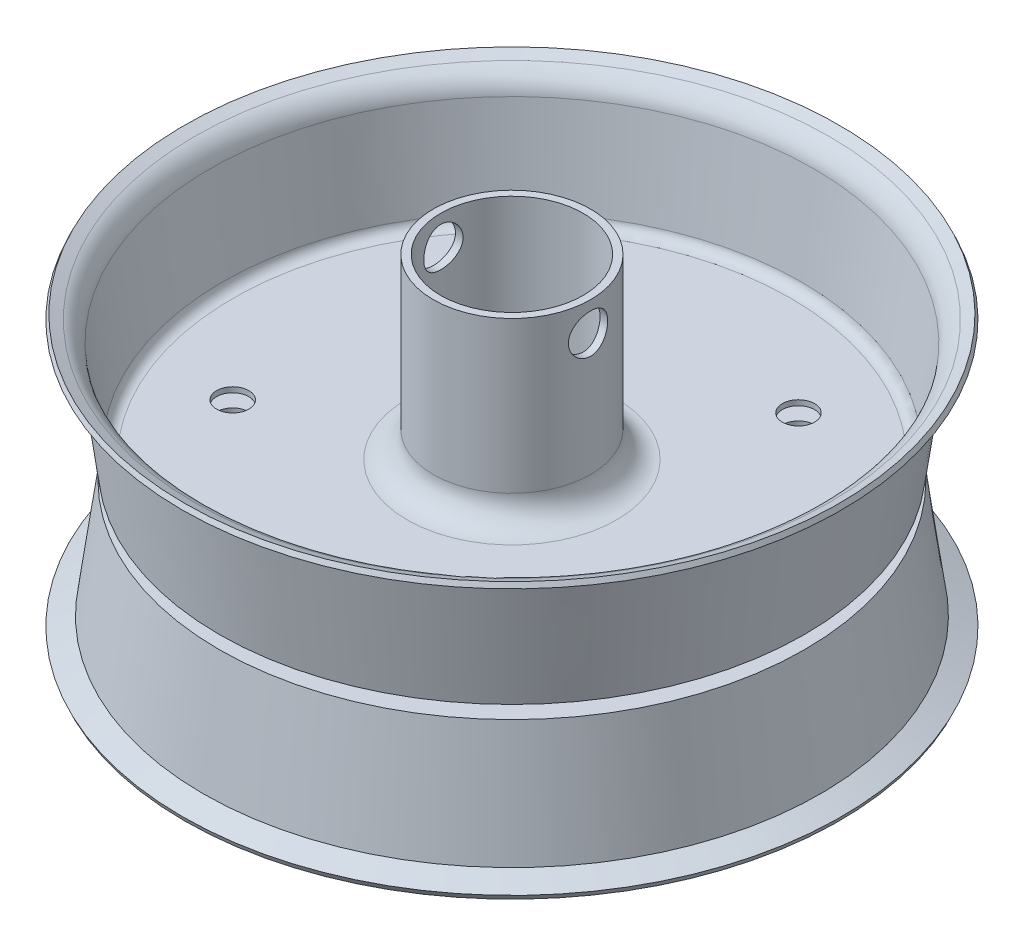
from build123d import *

# Parameters (mm, degrees)
SKETCH1_R                      = 19.05
SKETCH1_R_2                    = 17.272
BOSS_EXTRUDE1_DEPTH            = 73.152
FILLET1_R                      = 6.35
FILLET2_R                      = 2.54
FILLET3_R                      = 6.35
CUT_EXTRUDE1_REACH             = 122.908
SKETCH2_R                      = 3.9
FILLET1_OF_MIRROR1_R           = 6.35
FILLET2_OF_MIRROR1_R           = 2.54
FILLET3_OF_MIRROR1_R           = 6.35
CUT_EXTRUDE2_REACH             = 136.597
SKETCH4_R                      = 4.7625
CUT_EXTRUDE2_DIRECTION_2_REACH = 136.597


with BuildPart() as part:
    # Sketch1 → Boss-Extrude1 (new body)
    with BuildSketch(Plane(origin=(0, 0, 0), x_dir=(1, 0, 0), z_dir=(0, 1, 0))):
        with Locations(Location((0, 0, 0), (0, 0, 270))):
            Circle(SKETCH1_R)
        with Locations(Location((0, 0, 0), (0, 0, 270))):
            Circle(SKETCH1_R_2, mode=Mode.SUBTRACT)
    extrude(amount=BOSS_EXTRUDE1_DEPTH)

    # Sketch3 → Revolve1 (revolve)
    with BuildSketch(Plane(origin=(0, 0, 0), x_dir=(0, 0, -1), z_dir=(1, 0, 0))):
        Polygon((-19.05, 30.099), (-69.85, 30.099), (-73.66, 58.039), (-79.375, 60.579), (-79.890795852, 59.418459333), (-74.822704503, 57.165974289), (-70.958571646, 28.829), (-19.05, 28.829), align=None)
    revolve1 = revolve(axis=Axis((0, 73.152, 0), (0, -1, 0)))

    # Fillet1
    fillet1_edges = [part.edges().sort_by_distance(p)[0] for p in [
        (0, 30.099, -19.05),
    ]]
    fillet(fillet1_edges, radius=FILLET1_R)

    # Fillet2
    fillet2_edges = [part.edges().sort_by_distance(p)[0] for p in [
        (0, 30.099, -69.85),
    ]]
    fillet(fillet2_edges, radius=FILLET2_R)

    # Fillet3
    fillet3_edges = [part.edges().sort_by_distance(p)[0] for p in [
        (0, 58.039, -73.66),
    ]]
    fillet(fillet3_edges, radius=FILLET3_R)

    # Sketch2 → Cut-Extrude1 (cut, up to next)
    with BuildSketch(Plane(origin=(0, 30.099, 0), x_dir=(1, 0, 0), z_dir=(0, 1, 0)), mode=Mode.PRIVATE) as cut_extrude1_sk1:
        with Locations(Location((-34.614825389, 37.48444822, 0), (0, 0, 270))):
            Circle(SKETCH2_R)
    cut_extrude1_tool1 = extrude(cut_extrude1_sk1.sketch, amount=-CUT_EXTRUDE1_REACH, mode=Mode.PRIVATE) & part.part
    # Sketch2 → Cut-Extrude1 (cut, up to next)
    with BuildSketch(Plane(origin=(0, 30.099, 0), x_dir=(1, 0, 0), z_dir=(0, 1, 0)), mode=Mode.PRIVATE) as cut_extrude1_sk2:
        with Locations(Location((24.953259436, 44.503986772, 0), (0, 0, 270))):
            Circle(SKETCH2_R)
    cut_extrude1_tool2 = extrude(cut_extrude1_sk2.sketch, amount=-CUT_EXTRUDE1_REACH, mode=Mode.PRIVATE) & part.part
    # Sketch2 → Cut-Extrude1 (cut, up to next)
    with BuildSketch(Plane(origin=(0, 30.099, 0), x_dir=(1, 0, 0), z_dir=(0, 1, 0)), mode=Mode.PRIVATE) as cut_extrude1_sk3:
        with Locations(Location((50.036787851, -9.97947176, 0), (0, 0, 270))):
            Circle(SKETCH2_R)
    cut_extrude1_tool3 = extrude(cut_extrude1_sk3.sketch, amount=-CUT_EXTRUDE1_REACH, mode=Mode.PRIVATE) & part.part
    # Sketch2 → Cut-Extrude1 (cut, up to next)
    with BuildSketch(Plane(origin=(0, 30.099, 0), x_dir=(1, 0, 0), z_dir=(0, 1, 0)), mode=Mode.PRIVATE) as cut_extrude1_sk4:
        with Locations(Location((5.971176144, -50.671639509, 0), (0, 0, 270))):
            Circle(SKETCH2_R)
    cut_extrude1_tool4 = extrude(cut_extrude1_sk4.sketch, amount=-CUT_EXTRUDE1_REACH, mode=Mode.PRIVATE) & part.part
    # Sketch2 → Cut-Extrude1 (cut, up to next)
    with BuildSketch(Plane(origin=(0, 30.099, 0), x_dir=(1, 0, 0), z_dir=(0, 1, 0)), mode=Mode.PRIVATE) as cut_extrude1_sk5:
        with Locations(Location((-46.346398042, -21.337323722, 0), (0, 0, 270))):
            Circle(SKETCH2_R)
    cut_extrude1_tool5 = extrude(cut_extrude1_sk5.sketch, amount=-CUT_EXTRUDE1_REACH, mode=Mode.PRIVATE) & part.part
    cut_extrude1_1 = cut_extrude1_tool1.solids().sort_by_distance((-34.614825, 30.099, -37.484448))[0]
    add(cut_extrude1_1, mode=Mode.SUBTRACT)
    cut_extrude1_2 = cut_extrude1_tool2.solids().sort_by_distance((24.953259, 30.099, -44.503987))[0]
    add(cut_extrude1_2, mode=Mode.SUBTRACT)
    cut_extrude1_3 = cut_extrude1_tool3.solids().sort_by_distance((50.036788, 30.099, 9.979472))[0]
    add(cut_extrude1_3, mode=Mode.SUBTRACT)
    cut_extrude1_4 = cut_extrude1_tool4.solids().sort_by_distance((5.971176, 30.099, 50.67164))[0]
    add(cut_extrude1_4, mode=Mode.SUBTRACT)
    cut_extrude1_5 = cut_extrude1_tool5.solids().sort_by_distance((-46.346398, 30.099, 21.337324))[0]
    add(cut_extrude1_5, mode=Mode.SUBTRACT)
    cut_extrude1 = cut_extrude1_1 + cut_extrude1_2 + cut_extrude1_3 + cut_extrude1_4 + cut_extrude1_5  # Cut-Extrude1 as one shape, for the pattern or mirror that repeats it

    # Mirror1: Revolve1, Cut-Extrude1 across plane
    add(revolve1.mirror(Plane(origin=(0, 27.2415, 0), x_dir=(0, 0, 1), z_dir=(0, -1, 0))))
    add(cut_extrude1.mirror(Plane(origin=(0, 27.2415, 0), x_dir=(0, 0, 1), z_dir=(0, -1, 0))), mode=Mode.SUBTRACT)

    # Fillet1 of Mirror1
    fillet1_of_mirror1_edges = [part.edges().sort_by_distance(p)[0] for p in [
        (0, 24.384, -19.05),
    ]]
    fillet(fillet1_of_mirror1_edges, radius=FILLET1_OF_MIRROR1_R)

    # Fillet2 of Mirror1
    fillet2_of_mirror1_edges = [part.edges().sort_by_distance(p)[0] for p in [
        (0, 24.384, -69.85),
    ]]
    fillet(fillet2_of_mirror1_edges, radius=FILLET2_OF_MIRROR1_R)

    # Fillet3 of Mirror1
    fillet3_of_mirror1_edges = [part.edges().sort_by_distance(p)[0] for p in [
        (0, -3.556, -73.66),
    ]]
    fillet(fillet3_of_mirror1_edges, radius=FILLET3_OF_MIRROR1_R)

    # Sketch4 → Cut-Extrude2 (cut, up to next)
    with BuildSketch(Plane(origin=(0, 0, 0), x_dir=(0, 0, -1), z_dir=(1, 0, 0)), mode=Mode.PRIVATE) as cut_extrude2_sk1:
        with Locations(Location((0, 66.04, 0), (0, 0, 180))):
            Circle(SKETCH4_R)
    cut_extrude2_tool1 = extrude(cut_extrude2_sk1.sketch, amount=-CUT_EXTRUDE2_REACH, mode=Mode.PRIVATE) & part.part
    # Sketch4 → Cut-Extrude2 (cut, up to next)
    with BuildSketch(Plane(origin=(0, 0, 0), x_dir=(0, 0, -1), z_dir=(1, 0, 0)), mode=Mode.PRIVATE) as cut_extrude2_sk2:
        with Locations((0, 10.16)):
            Circle(SKETCH4_R)
    cut_extrude2_tool2 = extrude(cut_extrude2_sk2.sketch, amount=-CUT_EXTRUDE2_REACH, mode=Mode.PRIVATE) & part.part
    add(cut_extrude2_tool1.solids().sort_by_distance((0, 66.04, 0))[0], mode=Mode.SUBTRACT)
    add(cut_extrude2_tool2.solids().sort_by_distance((0, 10.16, 0))[0], mode=Mode.SUBTRACT)

    # Sketch4 → Cut-Extrude2 direction 2 (cut, up to next)
    with BuildSketch(Plane(origin=(0, 0, 0), x_dir=(0, 0, -1), z_dir=(1, 0, 0)), mode=Mode.PRIVATE) as cut_extrude2_direction_2_sk1:
        with Locations(Location((0, 66.04, 0), (0, 0, 180))):
            Circle(SKETCH4_R)
    cut_extrude2_direction_2_tool1 = extrude(cut_extrude2_direction_2_sk1.sketch, amount=CUT_EXTRUDE2_DIRECTION_2_REACH, mode=Mode.PRIVATE) & part.part
    # Sketch4 → Cut-Extrude2 direction 2 (cut, up to next)
    with BuildSketch(Plane(origin=(0, 0, 0), x_dir=(0, 0, -1), z_dir=(1, 0, 0)), mode=Mode.PRIVATE) as cut_extrude2_direction_2_sk2:
        with Locations((0, 10.16)):
            Circle(SKETCH4_R)
    cut_extrude2_direction_2_tool2 = extrude(cut_extrude2_direction_2_sk2.sketch, amount=CUT_EXTRUDE2_DIRECTION_2_REACH, mode=Mode.PRIVATE) & part.part
    add(cut_extrude2_direction_2_tool1.solids().sort_by_distance((0, 66.04, 0))[0], mode=Mode.SUBTRACT)
    add(cut_extrude2_direction_2_tool2.solids().sort_by_distance((0, 10.16, 0))[0], mode=Mode.SUBTRACT)


solid = part.part
